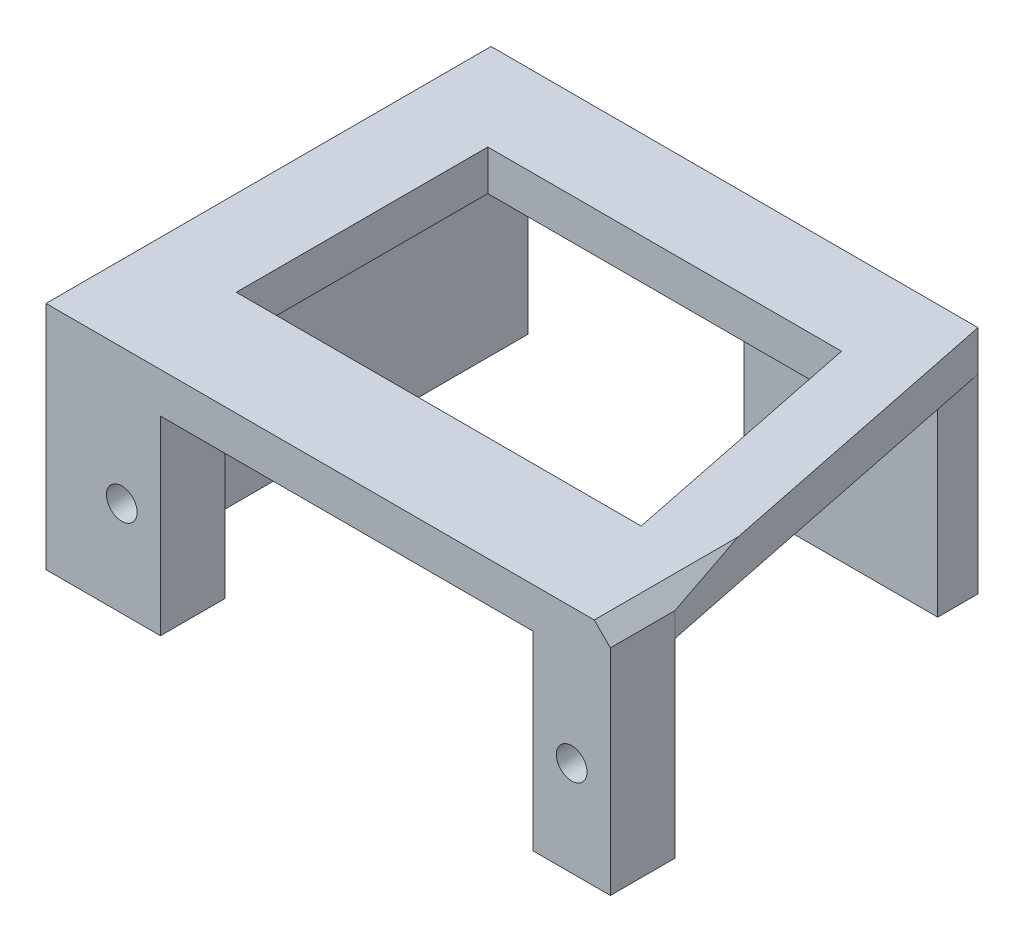
from build123d import *

# Parameters (mm, degrees)
SKETCH2_W           = 35
SKETCH2_H           = 27.6
BOSS_EXTRUDE1_DEPTH = 2.5
SKETCH3_W           = 12
SKETCH3_H           = 2.5
SKETCH3_W_2         = 4.8
SKETCH3_H_2         = 4
BOSS_EXTRUDE2_DEPTH = 11.8
SKETCH5_R           = 0.95
CUT_EXTRUDE2_DEPTH  = 11.8
SKETCH6_R           = 0.95
CUT_EXTRUDE3_DEPTH  = 11.8
CUT_EXTRUDE6_DEPTH  = 10
CHAMFER1_SIZE       = 1


with BuildPart() as part:
    # Sketch2 → Boss-Extrude1 (new body)
    with BuildSketch(Plane(origin=(0, 0, 0), x_dir=(1, 0, 0), z_dir=(0, 1, 0))):
        Rectangle(SKETCH2_W, SKETCH2_H)
    extrude(amount=BOSS_EXTRUDE1_DEPTH)

    # Sketch3 → Boss-Extrude2 (add)
    with BuildSketch(Plane.XZ):
        with Locations((6.7, -12.55)):
            Rectangle(SKETCH3_W, SKETCH3_H)
        with Locations((15.1, 11.8)):
            Rectangle(SKETCH3_W_2, SKETCH3_H_2)
        Polygon((-17.5, 13.8), (-15.2, 13.8), (-10.4, 13.8), (-10.4, 9.8), (-15.2, 9.8), (-15.2, -13.8), (-17.5, -13.8), align=None)
    extrude(amount=BOSS_EXTRUDE2_DEPTH)

    # Sketch5 → Cut-Extrude2 (cut)
    with BuildSketch(Plane(origin=(0, 0, -13.8), x_dir=(-1, 0, 0), z_dir=(0, 0, -1))):
        with Locations((-6.7, -6)):
            Circle(SKETCH5_R)
    extrude(amount=-CUT_EXTRUDE2_DEPTH, mode=Mode.SUBTRACT)

    # Sketch6 → Cut-Extrude3 (cut)
    with BuildSketch(Plane(origin=(0, 0, 9.8), x_dir=(-1, 0, 0), z_dir=(0, 0, -1))):
        with Locations((-15.1, -5.9)):
            Circle(SKETCH6_R)
        with Locations((12.8, -5.9)):
            Circle(SKETCH6_R)
    extrude(amount=-CUT_EXTRUDE3_DEPTH, mode=Mode.SUBTRACT)

    # Sketch11 → Cut-Extrude6 (cut)
    with BuildSketch(Plane(origin=(0, 0, 0), x_dir=(-1, 0, 0), z_dir=(0, -1, 0))):
        Polygon((-12.7, 13.8), (-17.5, -9.8), (-17.5, 13.8), align=None)
        Polygon((-12.909628956, -7.3), (-9.7367476, 8.3), (12.2, 8.3), (12.2, -7.3), align=None)
    extrude(amount=-CUT_EXTRUDE6_DEPTH, mode=Mode.SUBTRACT)

    # Chamfer1
    chamfer1_edges = [part.edges().sort_by_distance(p)[0] for p in [
        (17.5, 2.5, 11.8),
    ]]
    chamfer(chamfer1_edges, length=CHAMFER1_SIZE)


solid = part.part
